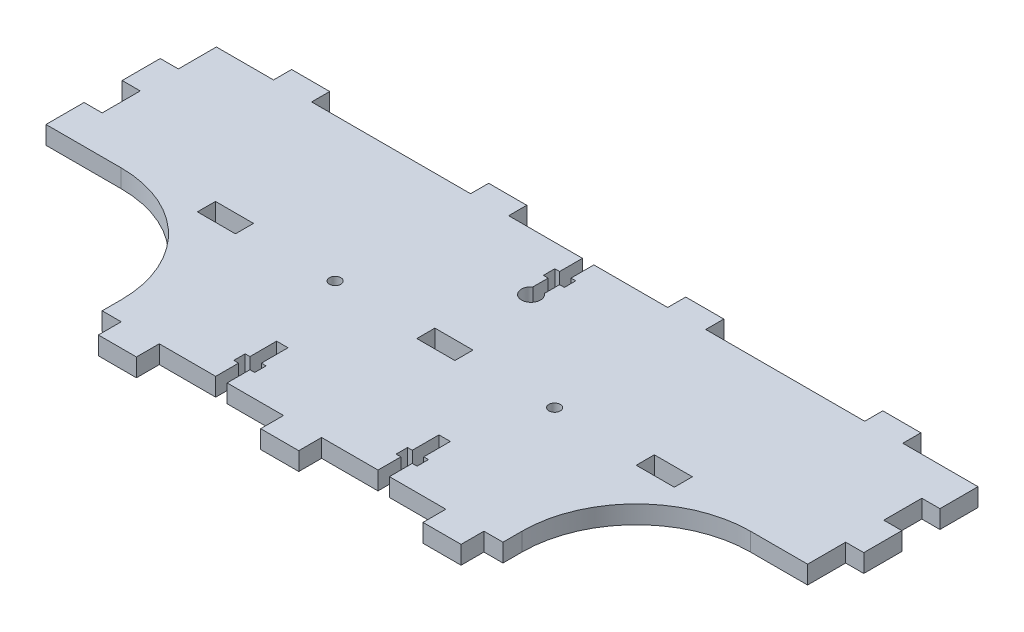
from build123d import *

# Parameters (mm, degrees)
SKETCH1_W           = 4.75
SKETCH1_H           = 10
SKETCH1_W_2         = 195.25
SKETCH1_H_2         = 75
SKETCH1_W_3         = 10
SKETCH1_H_3         = 6
SKETCH1_H_4         = 35
BOSS_EXTRUDE1_DEPTH = 4.75
SKETCH3_W           = 4.75
SKETCH3_H           = 35
CUT_EXTRUDE2_DEPTH  = 4.75
SKETCH4_W           = 3
SKETCH4_H           = 16
SKETCH4_W_2         = 5.5
SKETCH4_H_2         = 3
CUT_EXTRUDE3_DEPTH  = 4.75
SKETCH5_W           = 10
SKETCH5_H           = 4.75
CUT_EXTRUDE4_DEPTH  = 214.652901923
SKETCH6_R           = 1.5
CUT_EXTRUDE5_DEPTH  = 214.652901923
SKETCH7_W           = 10
SKETCH7_H           = 4.75
BOSS_EXTRUDE2_DEPTH = 4.75
SKETCH8_R           = 2.5
CUT_EXTRUDE6_DEPTH  = 216.366257803
SKETCH9_W           = 3
SKETCH9_H           = 16
SKETCH9_W_2         = 5.5
SKETCH9_H_2         = 3
CUT_EXTRUDE7_DEPTH  = 10


with BuildPart() as part:
    # Sketch1 → Boss-Extrude1 (new body)
    with BuildSketch(Plane(origin=(0, 0, 0), x_dir=(1, 0, 0), z_dir=(0, 1, 0))):
        with Locations((-197.625, 60)):
            Rectangle(SKETCH1_W, SKETCH1_H)
        with Locations((-97.625, 37.5)):
            Rectangle(SKETCH1_W_2, SKETCH1_H_2)
        with Locations((-140.25, -3)):
            Rectangle(SKETCH1_W_3, SKETCH1_H_3)
        with Locations((-97.625, -3)):
            Rectangle(SKETCH1_W_3, SKETCH1_H_3)
        with Locations((-55, -3)):
            Rectangle(SKETCH1_W_3, SKETCH1_H_3)
        with Locations((2.375, 17.5)):
            Rectangle(SKETCH1_W, SKETCH1_H_4)
        with Locations((2.375, 50)):
            Rectangle(SKETCH1_W, SKETCH1_H)
        with Locations((2.375, 70)):
            Rectangle(SKETCH1_W, SKETCH1_H)
        with Locations((-197.625, 40)):
            Rectangle(SKETCH1_W, SKETCH1_H)
    extrude(amount=BOSS_EXTRUDE1_DEPTH)

    # Sketch3 → Cut-Extrude2 (cut)
    with BuildSketch(Plane(origin=(0, 4.75, 0), x_dir=(1, 0, 0), z_dir=(0, 1, 0))):
        with BuildLine():
            Line((-180.25, 35), (-195.25, 35))
            Line((-195.25, 35), (-195.25, 0))
            Line((-195.25, 0), (-150.25, 0))
            Line((-150.25, 0), (-150.25, 5))
            ThreePointArc((-150.25, 5), (-159.036796564, 26.213203436), (-180.25, 35))
        make_face()
        with BuildLine():
            Line((-45, 0), (0, 0))
            Line((0, 0), (0, 35))
            Line((0, 35), (-15, 35))
            ThreePointArc((-15, 35), (-36.213203436, 26.213203436), (-45, 5))
            Line((-45, 5), (-45, 0))
        make_face()
        with Locations((2.375, 17.5)):
            Rectangle(SKETCH3_W, SKETCH3_H)
    extrude(amount=-CUT_EXTRUDE2_DEPTH, mode=Mode.SUBTRACT)

    # Sketch4 → Cut-Extrude3 (cut)
    with BuildSketch(Plane(origin=(0, 4.75, 0), x_dir=(1, 0, 0), z_dir=(0, 1, 0))):
        with Locations((-118.9375, 8)):
            Rectangle(SKETCH4_W, SKETCH4_H)
        with Locations((-76.3125, 8)):
            Rectangle(SKETCH4_W, SKETCH4_H)
        with Locations((-118.9375, 7.5)):
            Rectangle(SKETCH4_W_2, SKETCH4_H_2)
        with Locations((-76.3125, 7.5)):
            Rectangle(SKETCH4_W_2, SKETCH4_H_2)
    extrude(amount=-CUT_EXTRUDE3_DEPTH, mode=Mode.SUBTRACT)

    # Sketch5 → Cut-Extrude4 (cut, through all)
    with BuildSketch(Plane.XZ):
        with Locations((-155.25, -37.375)):
            Rectangle(SKETCH5_W, SKETCH5_H)
        with Locations((-97.625, -37.375)):
            Rectangle(SKETCH5_W, SKETCH5_H)
        with Locations((-40, -37.375)):
            Rectangle(SKETCH5_W, SKETCH5_H)
    extrude(amount=-CUT_EXTRUDE4_DEPTH, mode=Mode.SUBTRACT)

    # Sketch6 → Cut-Extrude5 (cut, through all)
    with BuildSketch(Plane.XZ):
        with Locations(Location((-68.8125, -37.375, 0), (0, 0, 270))):
            Circle(SKETCH6_R)
        with Locations(Location((-126.4375, -37.375, 0), (0, 0, 270))):
            Circle(SKETCH6_R)
    extrude(amount=-CUT_EXTRUDE5_DEPTH, mode=Mode.SUBTRACT)

    # Sketch7 → Boss-Extrude2 (add)
    with BuildSketch(Plane(origin=(0, 4.75, 0), x_dir=(1, 0, 0), z_dir=(0, 1, 0))):
        with Locations((-175.25, 77.375)):
            Rectangle(SKETCH7_W, SKETCH7_H)
        with Locations((-123.5, 77.375)):
            Rectangle(SKETCH7_W, SKETCH7_H)
        with Locations((-71.75, 77.375)):
            Rectangle(SKETCH7_W, SKETCH7_H)
        with Locations((-20, 77.375)):
            Rectangle(SKETCH7_W, SKETCH7_H)
    extrude(amount=-BOSS_EXTRUDE2_DEPTH)

    # Sketch8 → Cut-Extrude6 (cut, through all)
    with BuildSketch(Plane.XZ):
        with Locations(Location((-97.625, -60, 0), (0, 0, 270))):
            Circle(SKETCH8_R)
    extrude(amount=-CUT_EXTRUDE6_DEPTH, mode=Mode.SUBTRACT)

    # Sketch9 → Cut-Extrude7 (cut)
    with BuildSketch(Plane.XZ):
        with Locations((-97.625, -67)):
            Rectangle(SKETCH9_W, SKETCH9_H)
        with Locations((-97.625, -67.5)):
            Rectangle(SKETCH9_W_2, SKETCH9_H_2)
    extrude(amount=-CUT_EXTRUDE7_DEPTH, mode=Mode.SUBTRACT)


solid = part.part
